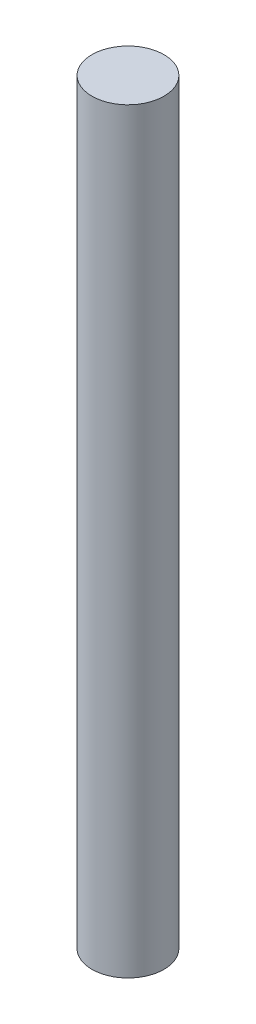
from build123d import *

# Parameters (mm, degrees)
BOSS_EXTRUDE1_DEPTH      = 50
BOSS_EXTRUDE1_DEPTH_BACK = 50
SKETCH1_R                = 4.7625


with BuildPart() as part:
    # Sketch1 → Boss-Extrude1 (new, two sides: drawn at the far end of the back side and taken through both)
    with BuildSketch(Plane(origin=(0, 0, 0), x_dir=(1, 0, 0), z_dir=(0, 1, 0)).offset(-BOSS_EXTRUDE1_DEPTH_BACK)):
        Circle(SKETCH1_R)
    extrude(amount=BOSS_EXTRUDE1_DEPTH + BOSS_EXTRUDE1_DEPTH_BACK)


solid = part.part
